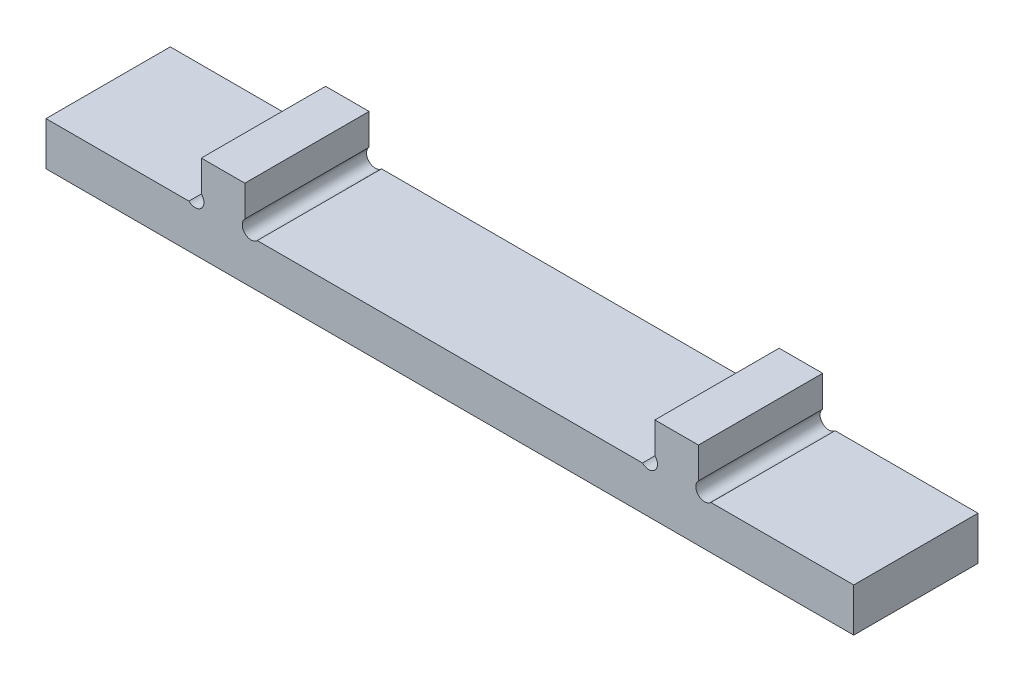
from build123d import *

# Parameters (mm, degrees)
BOSS_EXTRUDE1_DEPTH = 25.4


with BuildPart() as part:
    # Sketch1 → Boss-Extrude1 (new body)
    with BuildSketch(Plane.XY):
        with BuildLine():
            Line((-53.34, 4.445), (-82.55, 4.445))
            Line((-82.55, 4.445), (-82.55, -4.445))
            Line((-82.55, -4.445), (82.55, -4.445))
            Line((82.55, -4.445), (82.55, 4.445))
            Line((82.55, 4.445), (53.34, 4.445))
            ThreePointArc((53.34, 4.445), (50.8, 4.445), (50.8, 6.985))
            Line((50.8, 6.985), (50.8, 13.335))
            Line((50.8, 13.335), (41.91, 13.335))
            Line((41.91, 13.335), (41.91, 6.985))
            ThreePointArc((41.91, 6.985), (41.91, 4.445), (39.37, 4.445))
            Line((39.37, 4.445), (-39.37, 4.445))
            ThreePointArc((-39.37, 4.445), (-41.91, 4.445), (-41.91, 6.985))
            Line((-41.91, 6.985), (-41.91, 13.335))
            Line((-41.91, 13.335), (-50.8, 13.335))
            Line((-50.8, 13.335), (-50.8, 6.985))
            ThreePointArc((-50.8, 6.985), (-50.8, 4.445), (-53.34, 4.445))
        make_face()
    extrude(amount=BOSS_EXTRUDE1_DEPTH)


solid = part.part
